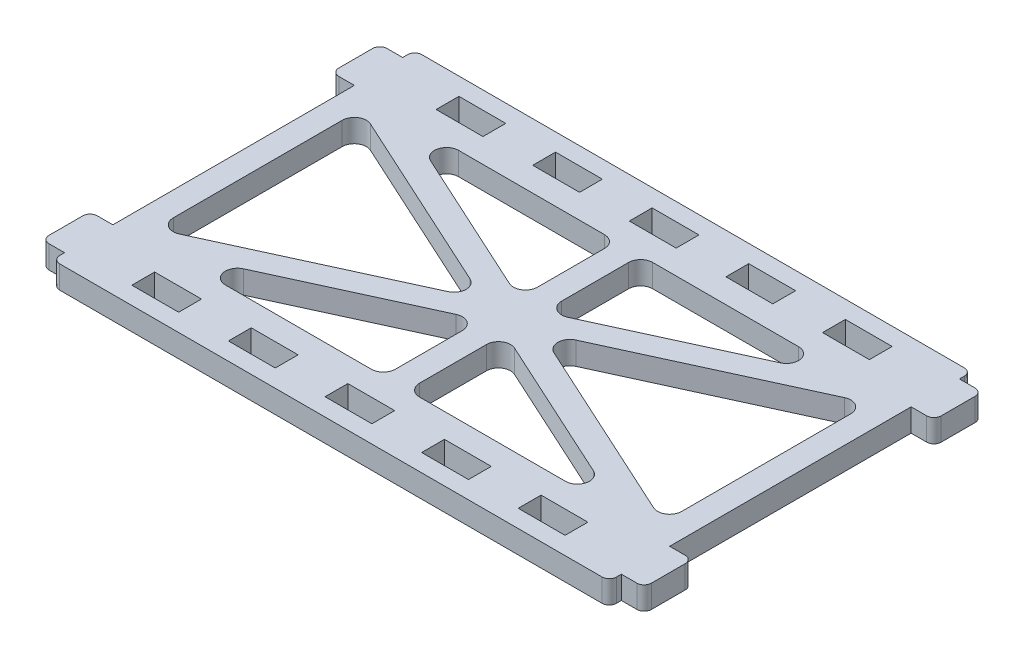
from build123d import *

# Parameters (mm, degrees)
SKETCH1_W           = 146.4
SKETCH1_H           = 95.25
BOSS_EXTRUDE1_DEPTH = 3
SKETCH2_W           = 6
SKETCH2_H           = 12.7
BOSS_EXTRUDE2_DEPTH = 6
SKETCH3_W           = 12.319
SKETCH3_H           = 6
CUT_EXTRUDE1_DEPTH  = 93.610909859
LPATTERN3_COUNT     = 3
LPATTERN3_PITCH     = 25.4
LPATTERN3_COL_COUNT = 3
LPATTERN3_COL_PITCH = 25.4
CUT_EXTRUDE2_DEPTH  = 93.610909859
FILLET1_R           = 3.175
FILLET2_R           = 1.905


with BuildPart() as part:
    # Sketch1 → Boss-Extrude1 (new, symmetric)
    with BuildSketch(Plane(origin=(0, 0, 0), x_dir=(1, 0, 0), z_dir=(0, 1, 0))):
        Rectangle(SKETCH1_W, SKETCH1_H)
    extrude(amount=BOSS_EXTRUDE1_DEPTH, both=True)

    # Sketch2 → Boss-Extrude2 (add)
    with BuildSketch(Plane(origin=(0, 3, 0), x_dir=(1, 0, 0), z_dir=(0, 1, 0))):
        with Locations((-76.2, 38.1)):
            Rectangle(SKETCH2_W, SKETCH2_H)
        with Locations((-76.2, -38.1)):
            Rectangle(SKETCH2_W, SKETCH2_H)
    boss_extrude2 = extrude(amount=-BOSS_EXTRUDE2_DEPTH)

    # Mirror1: Boss-Extrude2 across plane
    add(boss_extrude2.mirror(Plane(origin=(0, 0, 0), x_dir=(0, 0, 1), z_dir=(1, 0, 0))))

    # Sketch3 → Cut-Extrude1 (cut, symmetric)
    with BuildSketch(Plane(origin=(0, 3, 0), x_dir=(1, 0, 0), z_dir=(0, 1, 0))):
        with Locations((0, 40.005)):
            Rectangle(SKETCH3_W, SKETCH3_H)
        with Locations((0, -40.005)):
            Rectangle(SKETCH3_W, SKETCH3_H)
    cut_extrude1 = extrude(amount=CUT_EXTRUDE1_DEPTH, both=True, mode=Mode.SUBTRACT)

    # LPattern3: Cut-Extrude1 ×3
    with Locations(*[(i * LPATTERN3_PITCH, 0, 0) for i in range(1, LPATTERN3_COUNT)]):
        add(cut_extrude1, mode=Mode.SUBTRACT)

    # LPattern3 col: Cut-Extrude1 ×3
    with Locations(*[(-i * LPATTERN3_COL_PITCH, 0, 0) for i in range(1, LPATTERN3_COL_COUNT)]):
        add(cut_extrude1, mode=Mode.SUBTRACT)

    # Sketch4 → Cut-Extrude2 (cut, through all)
    with BuildSketch(Plane(origin=(0, 3, 0), x_dir=(1, 0, 0), z_dir=(0, 1, 0))):
        Polygon((-7.617051812, 0), (-66.85, 27.16209464), (-66.85, -27.16209464), align=None)
        Polygon((-3.175, 4.948845898), (-3.175, 30.655), (-59.232948188, 30.655), align=None)
        Polygon((59.232948188, 30.655), (3.175, 30.655), (3.175, 4.948845898), align=None)
        Polygon((66.85, -27.16209464), (66.85, 27.16209464), (7.617051812, 0), align=None)
        Polygon((59.232948188, -30.655), (3.175, -4.948845898), (3.175, -30.655), align=None)
        Polygon((-3.175, -30.655), (-3.175, -4.948845898), (-59.232948188, -30.655), align=None)
    extrude(amount=-CUT_EXTRUDE2_DEPTH, mode=Mode.SUBTRACT)

    # Fillet1
    fillet1_edges = [part.edges().sort_by_distance(p)[0] for p in [
        (66.85, 0, -27.16209464),
        (66.85, 0, 27.16209464),
        (7.617051812, 0, 0),
        (3.175, 0, 4.948845898),
        (59.232948188, 0, 30.655),
        (3.175, 0, 30.655),
        (3.175, 0, -30.655),
        (59.232948188, 0, -30.655),
        (3.175, 0, -4.948845898),
        (-59.232948188, 0, -30.655),
        (-3.175, 0, -30.655),
        (-3.175, 0, -4.948845898),
        (-3.175, 0, 4.948845898),
        (-3.175, 0, 30.655),
        (-59.232948188, 0, 30.655),
        (-7.617051812, 0, 0),
        (-66.85, 0, 27.16209464),
        (-66.85, 0, -27.16209464),
    ]]
    fillet(fillet1_edges, radius=FILLET1_R)

    # Fillet2
    fillet2_edges = [part.edges().sort_by_distance(p)[0] for p in [
        (-79.2, 0, -31.75),
        (-79.2, 0, -44.45),
        (-79.2, 0, 44.45),
        (-79.2, 0, 31.75),
        (79.2, 0, -31.75),
        (79.2, 0, -44.45),
        (79.2, 0, 44.45),
        (79.2, 0, 31.75),
        (-73.2, 0, -47.625),
        (73.2, 0, -47.625),
        (73.2, 0, 47.625),
        (-73.2, 0, 47.625),
    ]]
    fillet(fillet2_edges, radius=FILLET2_R)


solid = part.part
